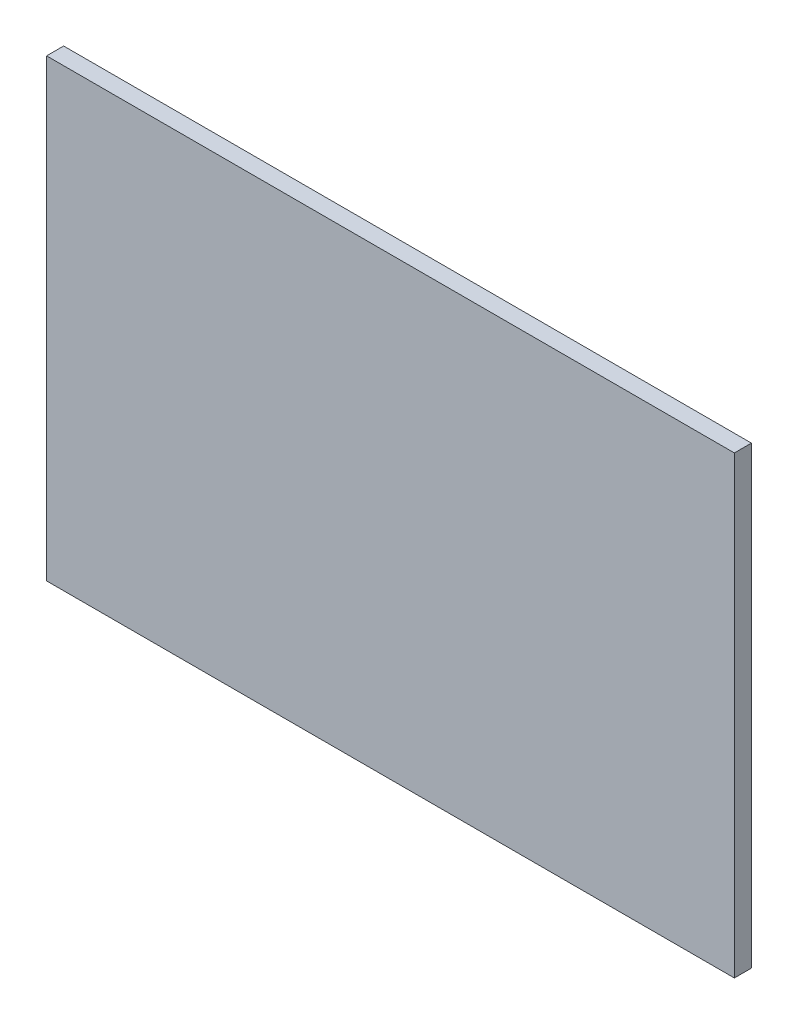
from build123d import *

# Parameters (mm, degrees)
ESQUISSE3_W        = 121
ESQUISSE3_H        = 80
BOSS_EXTRU_2_DEPTH = 3


with BuildPart() as part:
    # Esquisse3 → Boss.-Extru.2 (new body)
    with BuildSketch(Plane.XY):
        with Locations((3.99381853, -10.880639821)):
            Rectangle(ESQUISSE3_W, ESQUISSE3_H)
    extrude(amount=BOSS_EXTRU_2_DEPTH)


solid = part.part
